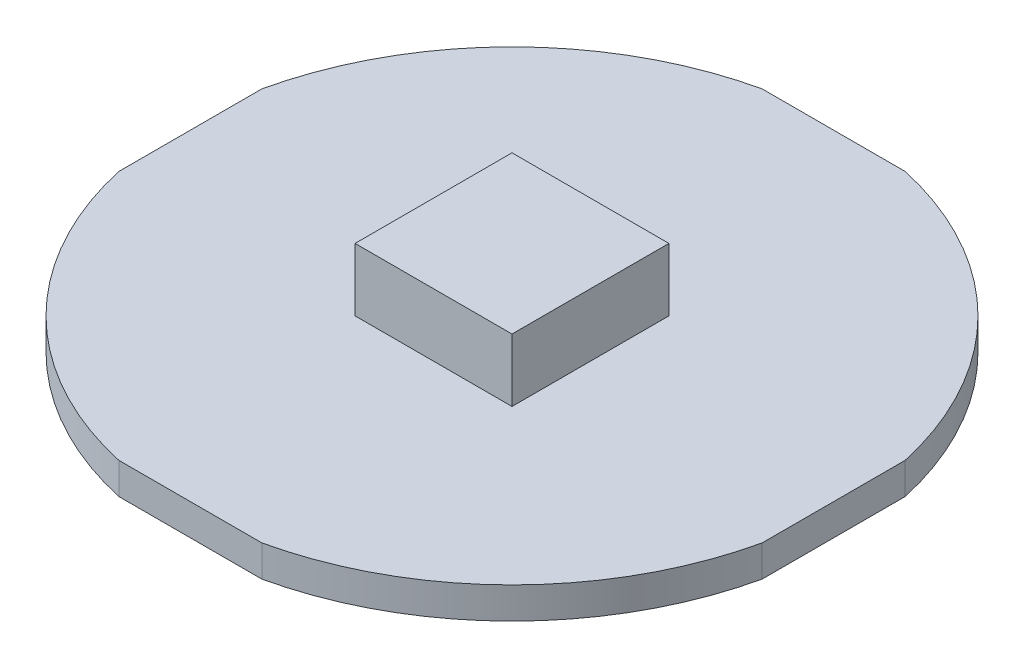
from build123d import *

# Parameters (mm, degrees)
SKETCH1_R           = 16.66875
BOSS_EXTRUDE1_DEPTH = 1.5875
CUT_EXTRUDE1_REACH  = 25.627
SKETCH3_W           = 7.9375
SKETCH3_H           = 7.9375
BOSS_EXTRUDE2_DEPTH = 3.175


with BuildPart() as part:
    # Sketch1 → Boss-Extrude1 (new body)
    with BuildSketch(Plane(origin=(0, 0, 0), x_dir=(1, 0, 0), z_dir=(0, 1, 0))):
        with Locations(Location((0, 0, 0), (0, 0, 270))):
            Circle(SKETCH1_R)
    extrude(amount=BOSS_EXTRUDE1_DEPTH)

    # Sketch2 → Cut-Extrude1 (cut, up to next)
    with BuildSketch(Plane(origin=(0, 1.5875, 0), x_dir=(1, 0, 0), z_dir=(0, 1, 0)), mode=Mode.PRIVATE) as cut_extrude1_sk1:
        with BuildLine():
            Line((-16.271875, 3.615703327), (-16.271875, -3.615703327))
            ThreePointArc((-16.271875, -3.615703327), (-16.66875, 0), (-16.271875, 3.615703327))
        make_face()
    cut_extrude1_tool1 = extrude(cut_extrude1_sk1.sketch, amount=-CUT_EXTRUDE1_REACH, mode=Mode.PRIVATE) & part.part
    # Sketch2 → Cut-Extrude1 (cut, up to next)
    with BuildSketch(Plane(origin=(0, 1.5875, 0), x_dir=(1, 0, 0), z_dir=(0, 1, 0)), mode=Mode.PRIVATE) as cut_extrude1_sk2:
        with BuildLine():
            Line((16.271875, 3.615703327), (16.271875, -3.615703327))
            ThreePointArc((16.271875, -3.615703327), (16.66875, 0), (16.271875, 3.615703327))
        make_face()
    cut_extrude1_tool2 = extrude(cut_extrude1_sk2.sketch, amount=-CUT_EXTRUDE1_REACH, mode=Mode.PRIVATE) & part.part
    # Sketch2 → Cut-Extrude1 (cut, up to next)
    with BuildSketch(Plane(origin=(0, 1.5875, 0), x_dir=(1, 0, 0), z_dir=(0, 1, 0)), mode=Mode.PRIVATE) as cut_extrude1_sk3:
        with BuildLine():
            Line((3.615703327, 16.271875), (-3.615703327, 16.271875))
            ThreePointArc((-3.615703327, 16.271875), (0, 16.66875), (3.615703327, 16.271875))
        make_face()
    cut_extrude1_tool3 = extrude(cut_extrude1_sk3.sketch, amount=-CUT_EXTRUDE1_REACH, mode=Mode.PRIVATE) & part.part
    # Sketch2 → Cut-Extrude1 (cut, up to next)
    with BuildSketch(Plane(origin=(0, 1.5875, 0), x_dir=(1, 0, 0), z_dir=(0, 1, 0)), mode=Mode.PRIVATE) as cut_extrude1_sk4:
        with BuildLine():
            Line((3.615703327, -16.271875), (-3.615703327, -16.271875))
            ThreePointArc((-3.615703327, -16.271875), (0, -16.66875), (3.615703327, -16.271875))
        make_face()
    cut_extrude1_tool4 = extrude(cut_extrude1_sk4.sketch, amount=-CUT_EXTRUDE1_REACH, mode=Mode.PRIVATE) & part.part
    add(cut_extrude1_tool1.solids().sort_by_distance((-16.430788, 1.5875, 0))[0], mode=Mode.SUBTRACT)
    add(cut_extrude1_tool2.solids().sort_by_distance((16.430788, 1.5875, 0))[0], mode=Mode.SUBTRACT)
    add(cut_extrude1_tool3.solids().sort_by_distance((0, 1.5875, -16.430788))[0], mode=Mode.SUBTRACT)
    add(cut_extrude1_tool4.solids().sort_by_distance((0, 1.5875, 16.430788))[0], mode=Mode.SUBTRACT)


with BuildPart() as body_2:
    # Sketch3 → Boss-Extrude2 (new body)
    with BuildSketch(Plane(origin=(0, 1.5875, 0), x_dir=(1, 0, 0), z_dir=(0, 1, 0))):
        Rectangle(SKETCH3_W, SKETCH3_H)
    extrude(amount=BOSS_EXTRUDE2_DEPTH)


solid = Compound([part.part, body_2.part])
